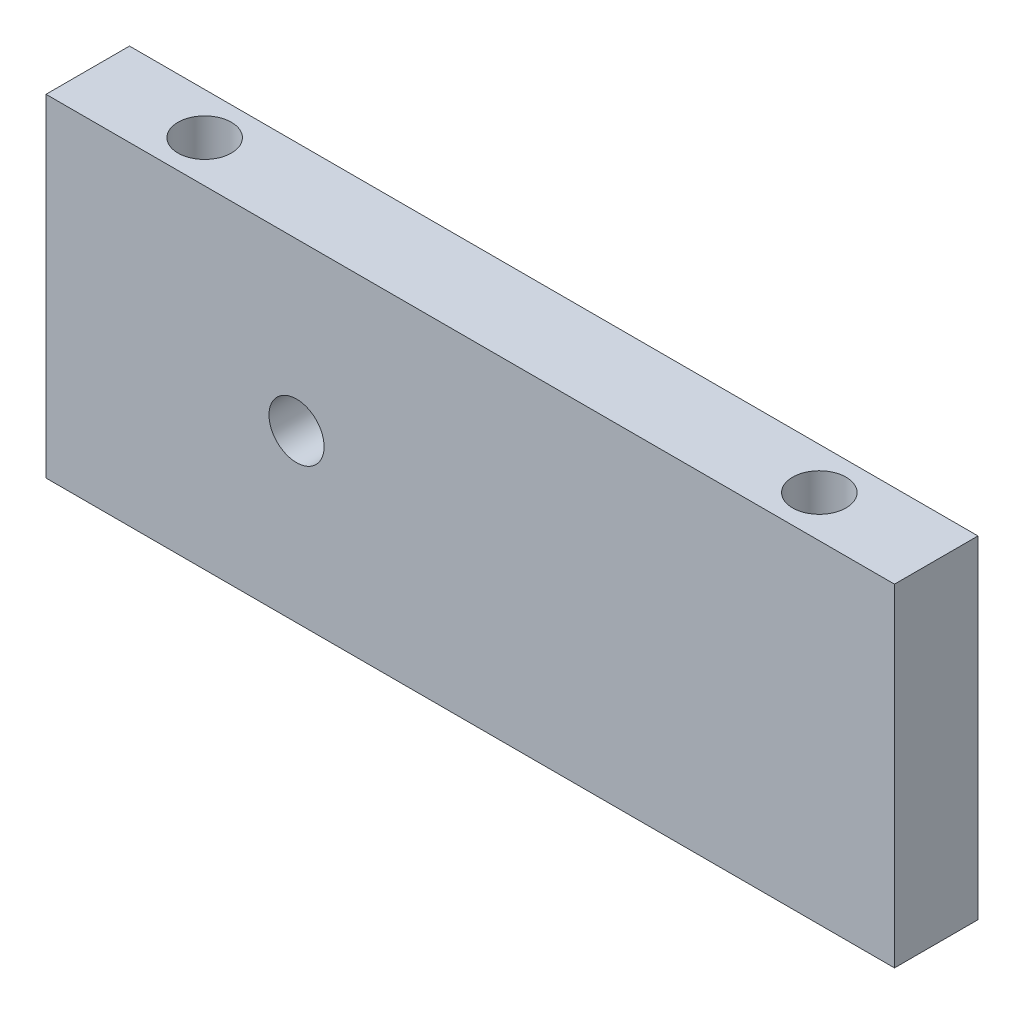
from build123d import *

# Parameters (mm, degrees)
ESQUISSE1_W             = 50.8
ESQUISSE1_H             = 19.9
EXTRUSION1_DEPTH        = 5
TROU_TARAUD_M4X0_71_D   = 3.3
ESQUISSE4_R             = 1.6
ENL_V_MAT_EXTRU_1_DEPTH = 42.263179713


with BuildPart() as part:
    # Esquisse1 → Extrusion1 (new body)
    with BuildSketch(Plane.XY):
        with Locations((10.4, 9.95)):
            Rectangle(ESQUISSE1_W, ESQUISSE1_H)
    extrude(amount=EXTRUSION1_DEPTH)

    # Trou taraudé M4x0.71 (through all)
    with Locations(Plane.XY.offset(5)):
        with Locations((0, 9.95)):
            Hole(TROU_TARAUD_M4X0_71_D / 2)

    # Esquisse4 → Enlèv. mat.-Extru.1 (cut, through all)
    with BuildSketch(Plane(origin=(0, 19.9, 0), x_dir=(1, 0, 0), z_dir=(0, 1, 0))):
        with Locations(Location((-8, -2.5, 0), (0, 0, 270))):
            Circle(ESQUISSE4_R)
        with Locations(Location((28.8, -2.5, 0), (0, 0, 270))):
            Circle(ESQUISSE4_R)
    extrude(amount=-ENL_V_MAT_EXTRU_1_DEPTH, mode=Mode.SUBTRACT)


solid = part.part
